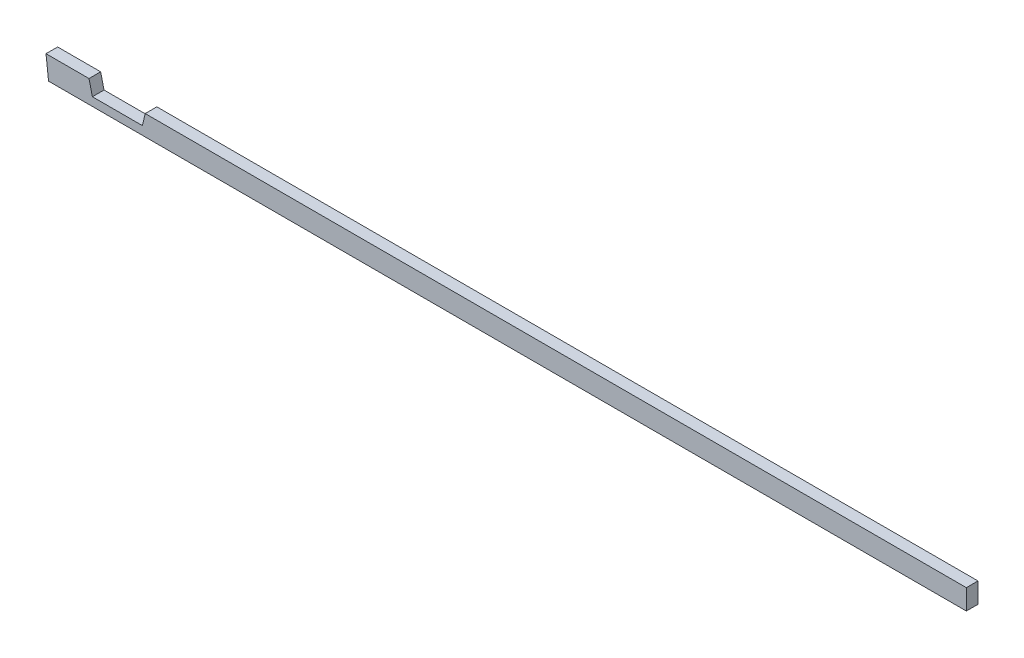
from build123d import *

# Parameters (mm, degrees)
BOSS_EXTRUDE1_DEPTH = 9.525


with BuildPart() as part:
    # Sketch1 → Boss-Extrude1 (new, symmetric)
    with BuildSketch(Plane.XY):
        Polygon((-742.898264889, 1.07156984), (-748.440342046, 24.13), (-818.783998967, 24.13), (-814.585479233, -12.7), (686.56861847, -12.7), (686.56861847, 20.438139689), (-656.565295631, 20.438139689), (-661.093476465, 1.07156984), align=None)
    extrude(amount=BOSS_EXTRUDE1_DEPTH, both=True)


solid = part.part
